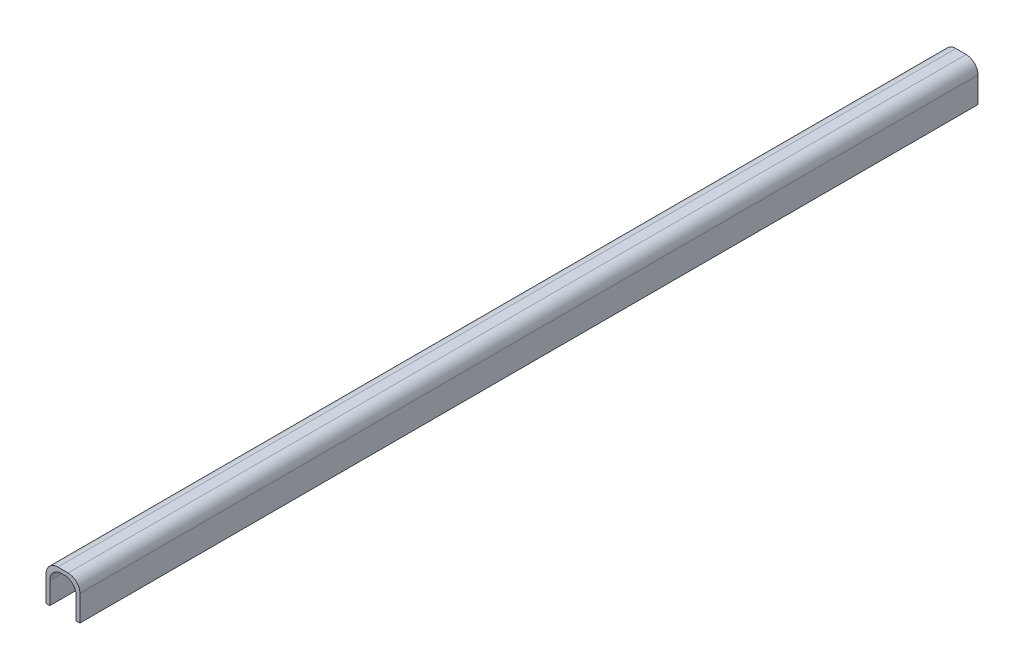
from build123d import *

# Parameters (mm, degrees)
BOSS_EXTRUDE1_DEPTH = 825
SKETCH3_W           = 95.704535521
SKETCH3_H           = 58.136059774
CUT_EXTRUDE2_DEPTH  = 825


with BuildPart() as part:
    # Sketch1 → Boss-Extrude1 (new body)
    with BuildSketch(Plane.XY):
        with BuildLine():
            Line((3.175, 0), (3.175, 18.575))
            ThreePointArc((3.175, 18.575), (6.103932188, 25.646067812), (13.175, 28.575))
            Line((13.175, 28.575), (15.527, 28.575))
            ThreePointArc((15.527, 28.575), (22.598067812, 25.646067812), (25.527, 18.575))
            Line((25.527, 18.575), (25.527, 0))
            Line((25.527, 0), (28.702, 0))
            Line((28.702, 0), (28.702, 21.75))
            ThreePointArc((28.702, 21.75), (25.773067812, 28.821067812), (18.702, 31.75))
            Line((18.702, 31.75), (10, 31.75))
            ThreePointArc((10, 31.75), (2.928932188, 28.821067812), (0, 21.75))
            Line((0, 21.75), (0, 0))
            Line((0, 0), (3.175, 0))
        make_face()
    extrude(amount=BOSS_EXTRUDE1_DEPTH)

    # Sketch3 → Cut-Extrude2 (cut)
    with BuildSketch(Plane(origin=(28.702, 0, 0), x_dir=(0, 0, -1), z_dir=(1, 0, 0))):
        with Locations((-807.852267761, 29.068029887)):
            Rectangle(SKETCH3_W, SKETCH3_H)
    extrude(amount=-CUT_EXTRUDE2_DEPTH, mode=Mode.SUBTRACT)


solid = part.part
